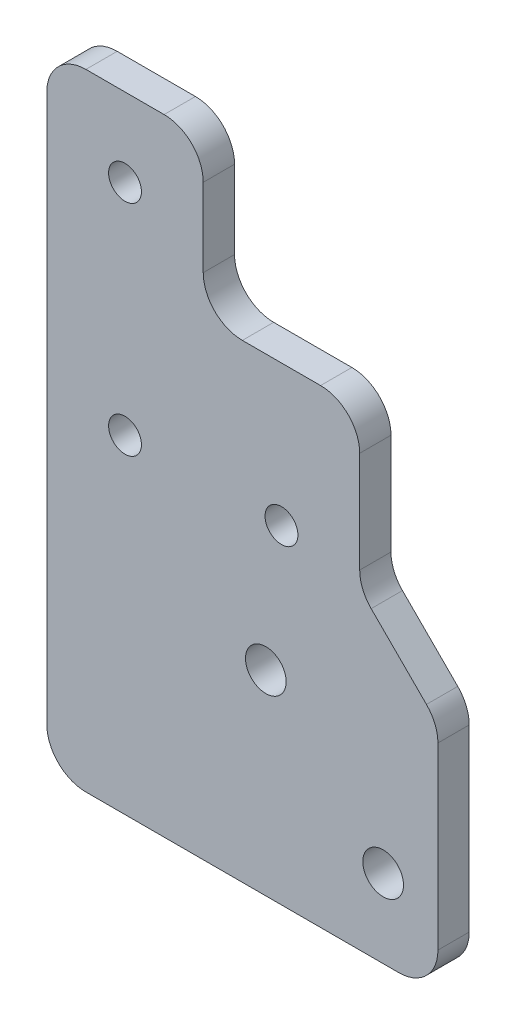
from build123d import *

# Parameters (mm, degrees)
MODEL_R         = 2.5999948
MODEL_R_2       = 2.0999958
EXTRUDE_1_DEPTH = 4


with BuildPart() as part:
    # Model → Бобышка-Вытянуть1 (new body)
    with BuildSketch(Plane.XY):
        with BuildLine():
            Line((308.392658055, 233.393719024), (308.392658055, 210.464832693))
            ThreePointArc((308.392658055, 210.464832693), (306.92819489, 206.929305859), (303.392668055, 205.464842693))
            Line((303.392668055, 205.464842693), (263.392748055, 205.464842693))
            ThreePointArc((263.392748055, 205.464842693), (259.85722122, 206.929305859), (258.392758055, 210.464832693))
            Line((258.392758055, 210.464832693), (258.392758055, 280.464692693))
            ThreePointArc((258.392758055, 280.464692693), (259.85722122, 284.000219528), (263.392748055, 285.464682693))
            Line((263.392748055, 285.464682693), (273.392728055, 285.464682693))
            ThreePointArc((273.392728055, 285.464682693), (276.92825489, 284.000219528), (278.392718055, 280.464692693))
            Line((278.392718055, 280.464692693), (278.392718055, 270.464712693))
            ThreePointArc((278.392718055, 270.464712693), (279.85718122, 266.929185859), (283.392708055, 265.464722693))
            Line((283.392708055, 265.464722693), (293.392688055, 265.464722693))
            ThreePointArc((293.392688055, 265.464722693), (296.92821489, 264.000259528), (298.392678055, 260.464732693))
            Line((298.392678055, 260.464732693), (298.392678055, 247.535826363))
            ThreePointArc((298.392678055, 247.535826363), (298.773279631, 245.622413028), (299.85714122, 244.000299528))
            Line((299.85714122, 244.000299528), (306.92819489, 236.929245859))
            ThreePointArc((306.92819489, 236.929245859), (308.012056479, 235.307132359), (308.392658055, 233.393719024))
        make_face()
        with Locations((286.392702055, 230.464792693)):
            Circle(MODEL_R, mode=Mode.SUBTRACT)
        with Locations((301.392672055, 215.464822693)):
            Circle(MODEL_R, mode=Mode.SUBTRACT)
        with Locations((268.392738055, 275.464702693)):
            Circle(MODEL_R_2, mode=Mode.SUBTRACT)
        with Locations((268.392738055, 247.464758693)):
            Circle(MODEL_R_2, mode=Mode.SUBTRACT)
        with Locations((288.392698055, 247.464758693)):
            Circle(MODEL_R_2, mode=Mode.SUBTRACT)
    extrude(amount=EXTRUDE_1_DEPTH)


solid = part.part
